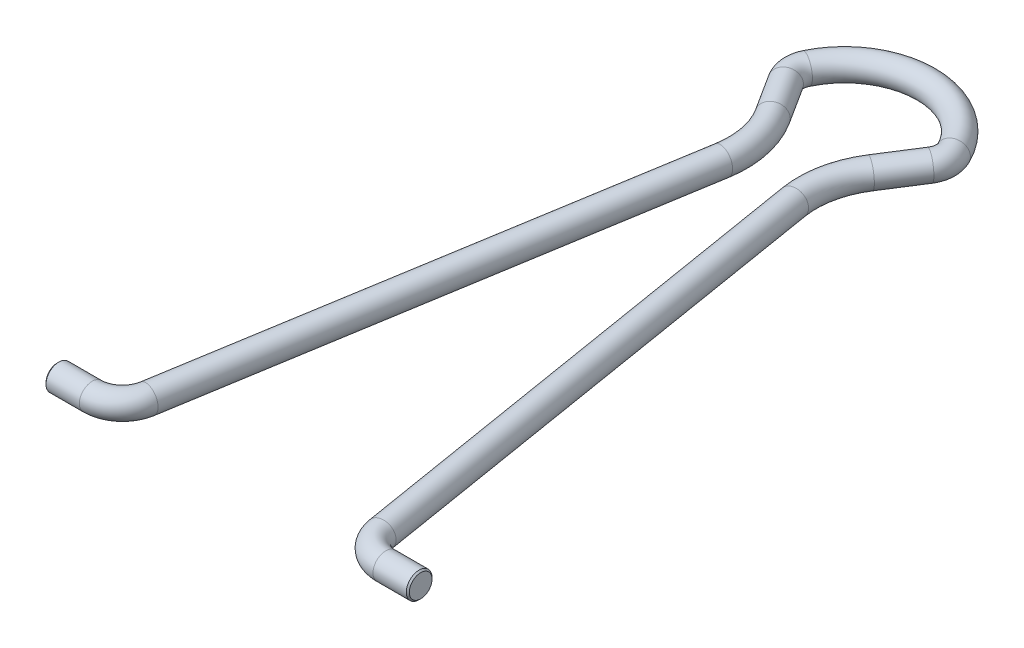
from build123d import *

# Parameters (mm, degrees)
SKETCH2_R     = 0.85
CHAMFER1_SIZE = 0.1


with BuildPart() as part:
    # Sweep2: sweep along a path in Sketch1
    with BuildLine(Plane(origin=(0, 0, 0), x_dir=(1, 0, 0), z_dir=(0, 1, 0))) as sweep2_path:
        Line((-12, -40), (-9.698387528, -40))
        ThreePointArc((-9.698387528, -40), (-8.403804383, -39.524484988), (-7.724814957, -38.324054479))
        Line((-7.724814957, -38.324054479), (-2.371685824, -5.722163438))
        ThreePointArc((-2.371685824, -5.722163438), (-2.41492462, -3.543666064), (-3.233291931, -1.524261364))
        Line((-3.233291931, -1.524261364), (-4.764777902, 0.87765625))
        ThreePointArc((-4.764777902, 0.87765625), (-4.997339075, 1.594784166), (-4.851667642, 2.334471248))
        ThreePointArc((-4.851667642, 2.334471248), (0, 5.384090909), (4.851667642, 2.334471248))
        ThreePointArc((4.851667642, 2.334471248), (4.997339075, 1.594784166), (4.764777902, 0.87765625))
        Line((4.764777902, 0.87765625), (3.233291931, -1.524261364))
        ThreePointArc((3.233291931, -1.524261364), (2.41492462, -3.543666064), (2.371685824, -5.722163438))
        Line((2.371685824, -5.722163438), (7.724814957, -38.324054479))
        ThreePointArc((7.724814957, -38.324054479), (8.403804383, -39.524484988), (9.698387528, -40))
        Line((9.698387528, -40), (12, -40))
    # Sketch2 → Sweep2 (sweep)
    with BuildSketch(Plane(origin=(-12, 0, 40), x_dir=(0, 0, 1), z_dir=(-1, 0, 0))):
        Circle(SKETCH2_R)
    sweep(path=sweep2_path.line)

    # Chamfer1
    chamfer1_edges = [part.edges().sort_by_distance(p)[0] for p in [
        (12, 0, 39.15),
        (-12, 0, 39.15),
    ]]
    chamfer(chamfer1_edges, length=CHAMFER1_SIZE)


solid = part.part
